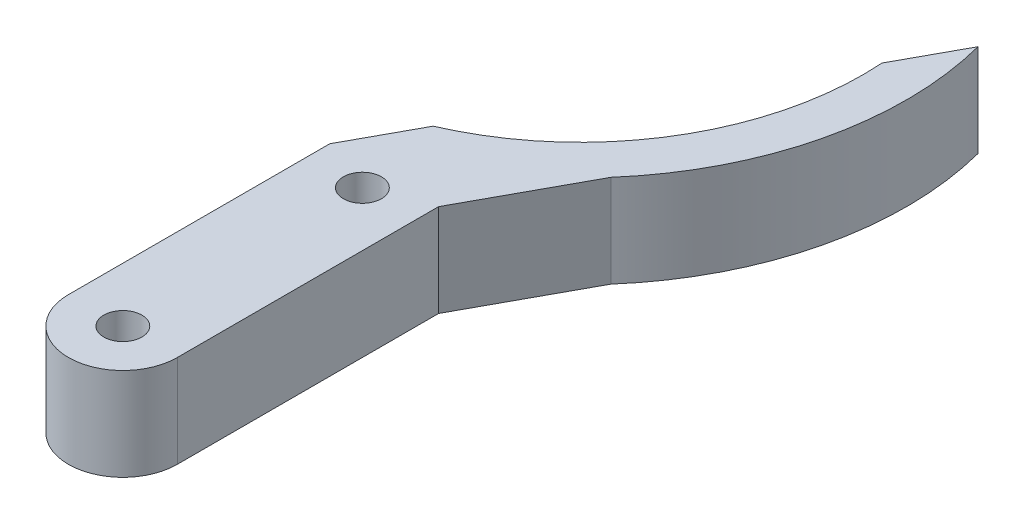
from build123d import *

# Parameters (mm, degrees)
SKETCH_1_R      = 1.75
EXTRUDE_1_DEPTH = 8.5


with BuildPart() as part:
    # 草图1 → 凸台-拉伸1 (new body)
    with BuildSketch(Plane(origin=(0, 0, 0), x_dir=(1, 0, 0), z_dir=(0, 1, 0))):
        with BuildLine():
            Line((-5, 0), (-5, 24))
            Line((-5, 24), (-1.652561305, 30.147735696))
            ThreePointArc((-1.652561305, 30.147735696), (10.212693953, 40.487182849), (13.939150793, 55.777767179))
            Line((13.939150793, 55.777767179), (17.049795585, 61.490619233))
            ThreePointArc((17.049795585, 61.490619233), (17.188178873, 47.06817383), (10.58000386, 34.247951355))
            Line((10.58000386, 34.247951355), (5, 24))
            Line((5, 24), (5, 0))
            ThreePointArc((5, 0), (0, -5), (-5, 0))
        make_face()
        with Locations(Location((0, 0, 0), (0, 0, 270))):
            Circle(SKETCH_1_R, mode=Mode.SUBTRACT)
        with Locations(Location((0, 22, 0), (0, 0, 270))):
            Circle(SKETCH_1_R, mode=Mode.SUBTRACT)
    extrude(amount=EXTRUDE_1_DEPTH)


solid = part.part
